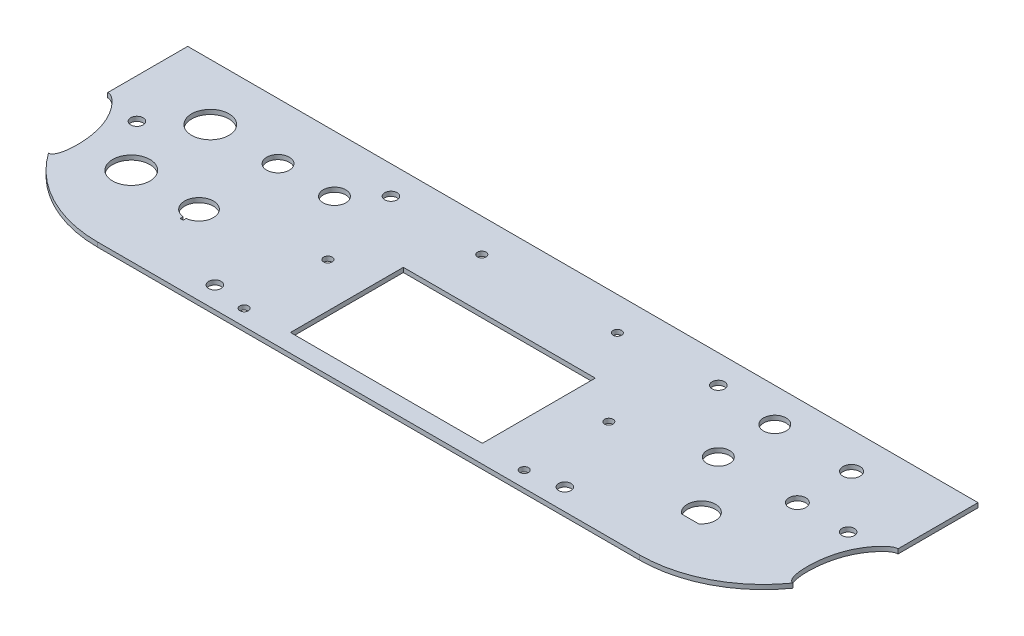
from build123d import *

# Parameters (mm, degrees)
BOSS_EXTRUDE1_DEPTH  = 2.54
SKETCH2_W            = 107.95
SKETCH2_H            = 63.5
CUT_EXTRUDE1_DEPTH   = 238.771783963
CUT_EXTRUDE4_START   = -2.54
CUT_EXTRUDE4_DEPTH   = 2.54
SKETCH4_R            = 4.7625
SKETCH4_R_2          = 6.35
SKETCH4_R_3          = 10.5
CUT_EXTRUDE3_DEPTH   = 238.771784093
M6_CLEARANCE_HOLE1_D = 7
M4_CLEARANCE_HOLE1_D = 4.8


with BuildPart() as part:
    # Sketch1 → Boss-Extrude1 (new body)
    with BuildSketch(Plane(origin=(0, 0, 0), x_dir=(1, 0, 0), z_dir=(0, 1, 0))):
        with BuildLine():
            Line((222.25, -14.612459999), (222.25, 36.187540001))
            Line((222.25, 36.187540001), (-222.25, 36.187540001))
            Line((-222.25, 36.187540001), (-222.25, -14.612459999))
            ThreePointArc((-222.25, -14.612459999), (-201.791408666, -64.003868664), (-152.4, -84.462459999))
            Line((-152.4, -84.462459999), (152.4, -84.462459999))
            ThreePointArc((152.4, -84.462459999), (201.791408666, -64.003868664), (222.25, -14.612459999))
        make_face()
    extrude(amount=BOSS_EXTRUDE1_DEPTH)

    # Sketch2 → Cut-Extrude1 (cut, through all)
    with BuildSketch(Plane(origin=(0, 2.54, 0), x_dir=(1, 0, 0), z_dir=(0, 1, 0))):
        with Locations((0, -42.552459999)):
            Rectangle(SKETCH2_W, SKETCH2_H)
    extrude(amount=-CUT_EXTRUDE1_DEPTH, mode=Mode.SUBTRACT)

    # Sketch5 → Cut-Extrude4 (cut)
    with BuildSketch(Plane(origin=(0, 2.54, 0), x_dir=(1, 0, 0), z_dir=(0, 1, 0)).offset(CUT_EXTRUDE4_START)):
        with BuildLine():
            ThreePointArc((-222.25, -14.612459999), (-218.970589391, -35.763798683), (-209.440289817, -54.929055063))
            add(Edge.make_bspline(
                [(-209.440289817, -54.929055063), (-204.823931799, -55.506078622), (-202.304901657, -25.266816537), (-219.26819847, -8.373976847), (-222.25, -8.829558466)],
                knots=[0, 0, 0, 0, 0.32580352, 0.516674914, 0.516674914, 0.516674914, 0.516674914], degree=3))
            Line((-222.25, -8.829558466), (-222.25, -14.612459999))
        make_face()
        with BuildLine():
            add(Edge.make_bspline(
                [(-222.25, -8.829558466), (-229.800526338, -9.983183543), (-216.288594077, -54.073048471), (-209.440289817, -54.929055063)],
                knots=[0.516674914, 0.516674914, 0.516674914, 0.516674914, 1, 1, 1, 1], degree=3))
            ThreePointArc((-209.440289817, -54.929055063), (-218.970589391, -35.763798683), (-222.25, -14.612459999))
            Line((-222.25, -14.612459999), (-222.25, -8.829558466))
        make_face()
        with BuildLine():
            add(Edge.make_bspline(
                [(209.440289817, -54.929055063), (204.823931799, -55.506078622), (202.304901657, -25.266816537), (235.136564978, 7.428480335), (216.288594077, -54.073048471), (209.440289817, -54.929055063)],
                knots=[0, 0, 0, 0, 0.32580352, 0.516674914, 1, 1, 1, 1], degree=3))
        make_face()
    extrude(amount=CUT_EXTRUDE4_DEPTH, mode=Mode.SUBTRACT)

    # Sketch4 → Cut-Extrude3 (cut, through all)
    with BuildSketch(Plane(origin=(0, 2.54, 0), x_dir=(1, 0, 0), z_dir=(0, 1, 0))):
        with Locations(Location((171.45, 15.867540001, 0), (0, 0, 270))):
            Circle(SKETCH4_R)
        with Locations(Location((-139.7, 4.437540001, 0), (0, 0, 270))):
            Circle(SKETCH4_R_2)
        with Locations(Location((127, 17.137540001, 0), (0, 0, 270))):
            Circle(SKETCH4_R_2)
        with Locations(Location((127, -14.612459999, 0), (0, 0, 270))):
            Circle(SKETCH4_R_2)
        with Locations(Location((171.45, -14.612459999, 0), (0, 0, 270))):
            Circle(SKETCH4_R)
        with Locations(Location((-177.8, -40.012459999, 0), (0, 0, 270))):
            Circle(SKETCH4_R_3)
        with Locations(Location((-177.8, 4.437540001, 0), (0, 0, 270))):
            Circle(SKETCH4_R_3)
        with Locations(Location((-107.95, 4.437540001, 0), (0, 0, 270))):
            Circle(SKETCH4_R_2)
        with BuildLine():
            Line((-140.55, -48.067737772), (-140.55, -49.812459999))
            Line((-140.55, -49.812459999), (-138.85, -49.812459999))
            Line((-138.85, -49.812459999), (-138.85, -48.067737772))
            ThreePointArc((-138.85, -48.067737772), (-139.7, -31.912459999), (-140.55, -48.067737772))
        make_face()
        with BuildLine():
            Line((153.9875, -52.712459999), (144.4625, -52.712459999))
            ThreePointArc((144.4625, -52.712459999), (149.225, -38.424959999), (153.9875, -52.712459999))
        make_face()
    extrude(amount=-CUT_EXTRUDE3_DEPTH, mode=Mode.SUBTRACT)

    # M6 Clearance Hole1 (through all)
    with Locations(Plane.XZ):
        with Locations((92.075, -20.32), (200.025000005, 14.612459999), (98.425, 72.39), (-92.075, -20.32), (-200.025000005, 14.612459999), (-98.425, 72.39)):
            Hole(M6_CLEARANCE_HOLE1_D / 2)

    # M4 Clearance Hole1 (through all)
    with Locations(Plane(origin=(0, 2.54, 0), x_dir=(1, 0, 0), z_dir=(0, 1, 0))):
        with Locations((-78.7827, -75.5731381), (-79, -28.2331381), (-38.130967929, 17.4595619), (38.130967929, 17.4595619), (79, -28.2331381), (78.7827, -75.5731381)):
            Hole(M4_CLEARANCE_HOLE1_D / 2)


solid = part.part
